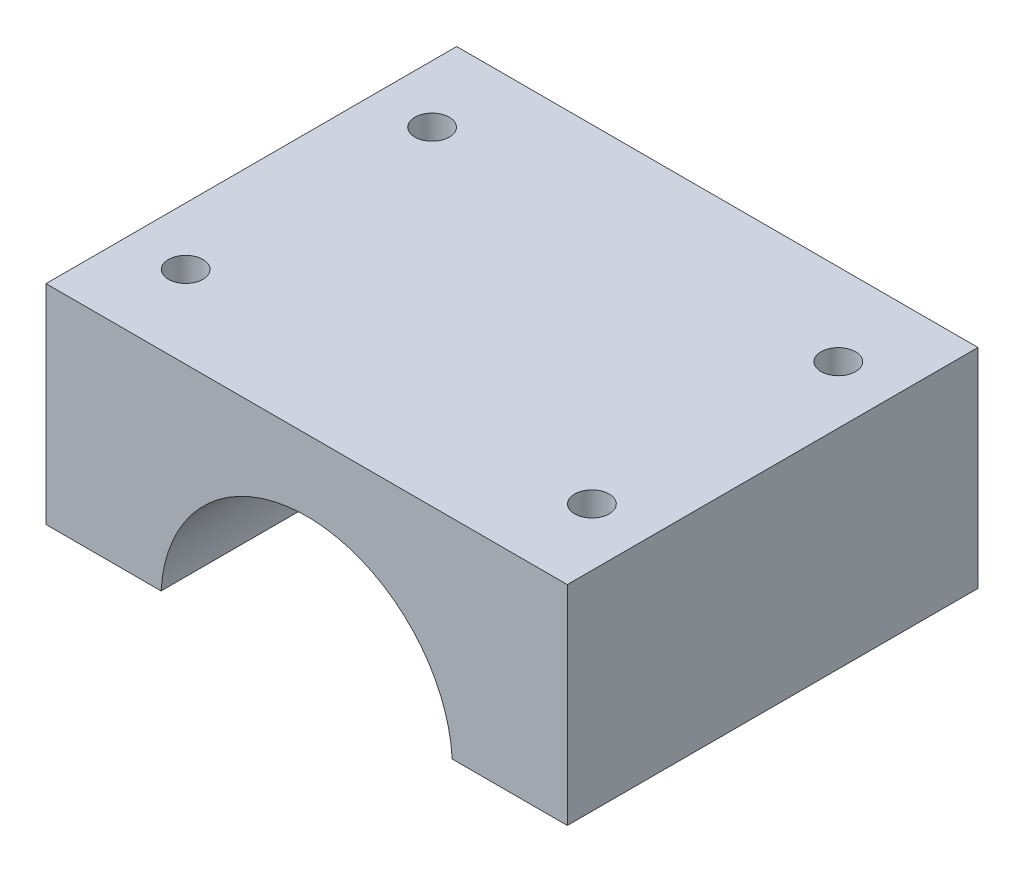
from build123d import *

# Parameters (mm, degrees)
BOSS_EXTRUDE1_DEPTH         = 50
BOSS_EXTRUDE2_START         = -50
BOSS_EXTRUDE2_DEPTH         = 50
TAP_DRILL_FOR_M5X0_8_TAP1_D = 4.2
CUT_EXTRUDE1_REACH          = 69.195
SKETCH5_W                   = 63.468496122
SKETCH5_H                   = 5.35


with BuildPart() as part:
    # Sketch1 → Boss-Extrude1 (new body)
    with BuildSketch(Plane.XY):
        with BuildLine():
            Line((-31.734248061, 1), (-17.721808598, 1))
            ThreePointArc((-17.721808598, 1), (0, 17.75), (17.721808598, 1))
            Line((17.721808598, 1), (31.734248061, 1))
            ThreePointArc((31.734248061, 1), (0, 31.75), (-31.734248061, 1))
        make_face()
    extrude(amount=BOSS_EXTRUDE1_DEPTH)

    # Sketch4 → Boss-Extrude2 (add)
    with BuildSketch(Plane.XY.offset(50).offset(BOSS_EXTRUDE2_START)):
        with BuildLine():
            Line((31.734248061, 31.75), (0, 31.75))
            ThreePointArc((0, 31.75), (22.094258304, 22.801452805), (31.734248061, 1))
            Line((31.734248061, 1), (31.734248061, 31.75))
        make_face()
        with BuildLine():
            ThreePointArc((-31.734248061, 1), (-22.094258304, 22.801452805), (0, 31.75))
            Line((0, 31.75), (-31.734248061, 31.75))
            Line((-31.734248061, 31.75), (-31.734248061, 1))
        make_face()
    extrude(amount=BOSS_EXTRUDE2_DEPTH)

    # Tap Drill for M5x0.8 Tap1 (through all)
    with Locations(Plane(origin=(-24.72802833, 1, 40), x_dir=(0, 0, -1), z_dir=(0, -1, 0))):
        with Locations((0, 0), (30, 0), (0, 49.45605666), (30, 49.45605666)):
            Hole(TAP_DRILL_FOR_M5X0_8_TAP1_D / 2)

    # Sketch5 → Cut-Extrude1 (cut, up to next)
    with BuildSketch(Plane.XY.offset(50), mode=Mode.PRIVATE) as cut_extrude1_sk1:
        with Locations((0, 29.075)):
            Rectangle(SKETCH5_W, SKETCH5_H)
    cut_extrude1_tool1 = extrude(cut_extrude1_sk1.sketch, amount=-CUT_EXTRUDE1_REACH, mode=Mode.PRIVATE) & part.part
    add(cut_extrude1_tool1.solids().sort_by_distance((0, 29.075, 50))[0], mode=Mode.SUBTRACT)


solid = part.part
